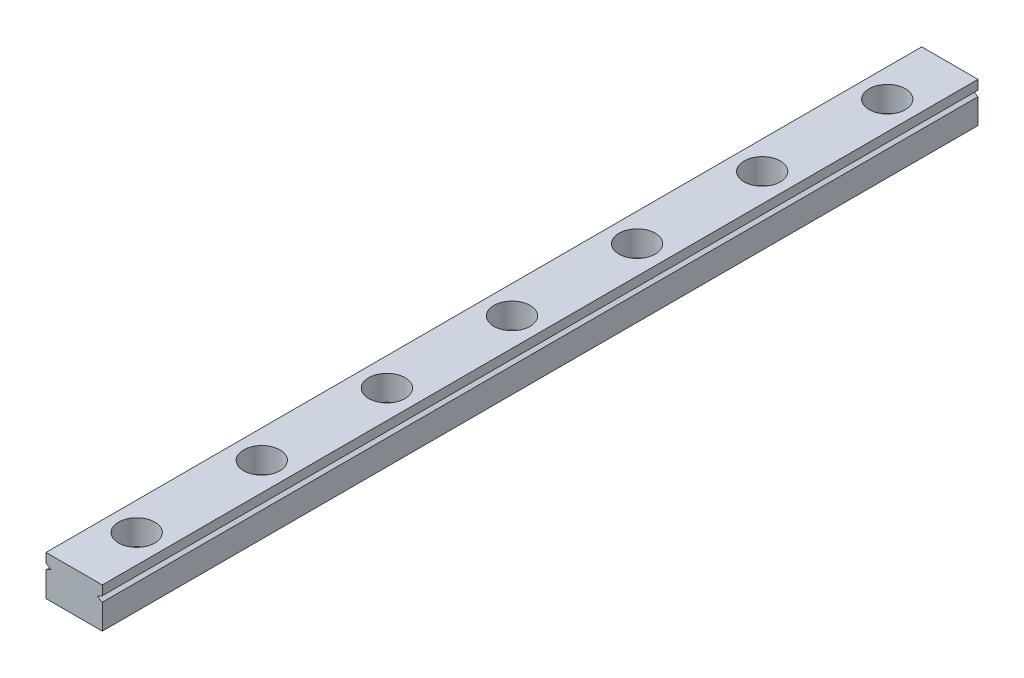
from build123d import *

# Parameters (mm, degrees)
BOSS_EXTRUDE1_DEPTH = 140
SKETCH2_R           = 2.9
CUT_EXTRUDE1_DEPTH  = 4
SKETCH3_R           = 1.7
CUT_EXTRUDE2_DEPTH  = 141.346001012


with BuildPart() as part:
    # Sketch1 → Boss-Extrude1 (new body)
    with BuildSketch(Plane.XY):
        Polygon((9, 6.4), (9, 4.9), (8.2, 4.45), (9, 4), (9, 0), (0, 0), (0, 4), (0.8, 4.45), (0, 4.9), (0, 6.4), align=None)
    extrude(amount=BOSS_EXTRUDE1_DEPTH)

    # Sketch2 → Cut-Extrude1 (cut)
    with BuildSketch(Plane(origin=(0, 6.4, 0), x_dir=(1, 0, 0), z_dir=(0, 1, 0))):
        with Locations(Location((4.5, -130, 0), (0, 0, 270))):
            Circle(SKETCH2_R)
        with Locations(Location((4.5, -110, 0), (0, 0, 270))):
            Circle(SKETCH2_R)
        with Locations(Location((4.5, -90, 0), (0, 0, 270))):
            Circle(SKETCH2_R)
        with Locations(Location((4.5, -70, 0), (0, 0, 270))):
            Circle(SKETCH2_R)
        with Locations(Location((4.5, -50, 0), (0, 0, 270))):
            Circle(SKETCH2_R)
        with Locations(Location((4.5, -30, 0), (0, 0, 270))):
            Circle(SKETCH2_R)
        with Locations(Location((4.5, -10, 0), (0, 0, 270))):
            Circle(SKETCH2_R)
    extrude(amount=-CUT_EXTRUDE1_DEPTH, mode=Mode.SUBTRACT)

    # Sketch3 → Cut-Extrude2 (cut, through all)
    with BuildSketch(Plane(origin=(0, 2.4, 0), x_dir=(1, 0, 0), z_dir=(0, 1, 0))):
        with Locations(Location((4.5, -130, 0), (0, 0, 270))):
            Circle(SKETCH3_R)
        with Locations(Location((4.5, -110, 0), (0, 0, 270))):
            Circle(SKETCH3_R)
        with Locations(Location((4.5, -90, 0), (0, 0, 270))):
            Circle(SKETCH3_R)
        with Locations(Location((4.5, -70, 0), (0, 0, 270))):
            Circle(SKETCH3_R)
        with Locations(Location((4.5, -50, 0), (0, 0, 270))):
            Circle(SKETCH3_R)
        with Locations(Location((4.5, -30, 0), (0, 0, 270))):
            Circle(SKETCH3_R)
        with Locations(Location((4.5, -10, 0), (0, 0, 270))):
            Circle(SKETCH3_R)
    extrude(amount=-CUT_EXTRUDE2_DEPTH, mode=Mode.SUBTRACT)


solid = part.part
